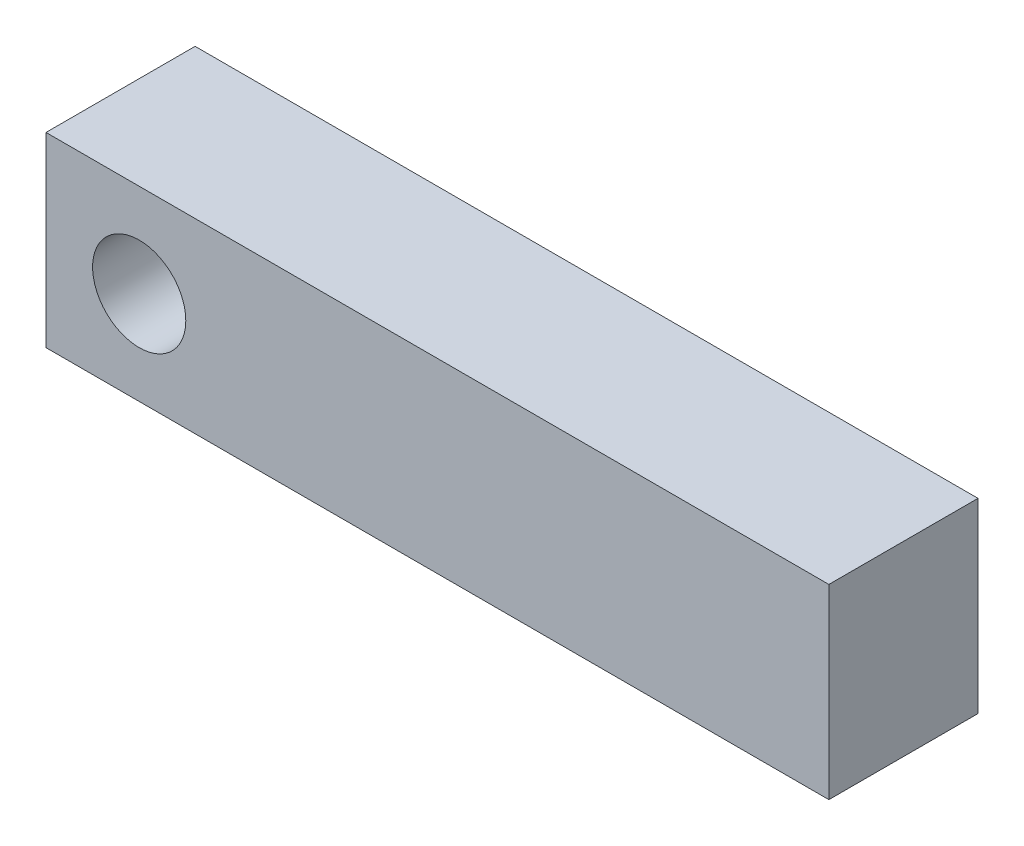
from build123d import *

# Parameters (mm, degrees)
CROQUIS1_W              = 210
CROQUIS1_H              = 50
CROQUIS1_R              = 12.5
SALIENTE_EXTRUIR1_DEPTH = 40


with BuildPart() as part:
    # Croquis1 → Saliente-Extruir1 (new body)
    with BuildSketch(Plane.XY):
        with Locations((80, 0)):
            Rectangle(CROQUIS1_W, CROQUIS1_H)
        Circle(CROQUIS1_R, mode=Mode.SUBTRACT)
    extrude(amount=SALIENTE_EXTRUIR1_DEPTH)


solid = part.part
